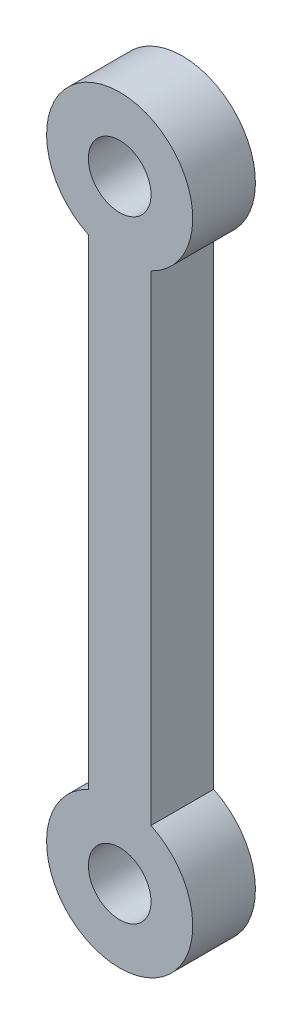
from build123d import *

# Parameters (mm, degrees)
ESTRUSIONE_ESTRUSIONE2_DEPTH = 3
TAGLIO_ESTRUSIONE7_START     = 3
SCHIZZO3_R                   = 1.5
TAGLIO_ESTRUSIONE7_DEPTH     = 71.735847184


with BuildPart() as part:
    # Schizzo2 → Estrusione-Estrusione2 (new body)
    with BuildSketch(Plane.XY):
        with BuildLine():
            Line((-34.111088775, -27.566511085), (-34.111088775, -50.566511085))
            ThreePointArc((-34.111088775, -50.566511085), (-32.611088775, -57.228788745), (-31.111088775, -50.566511085))
            Line((-31.111088775, -50.566511085), (-31.111088775, -27.566511085))
            ThreePointArc((-31.111088775, -27.566511085), (-32.611088775, -20.904233425), (-34.111088775, -27.566511085))
        make_face()
    extrude(amount=ESTRUSIONE_ESTRUSIONE2_DEPTH)

    # Schizzo3 → Taglio-Estrusione7 (cut, through all)
    with BuildSketch(Plane.XY.offset(TAGLIO_ESTRUSIONE7_START)):
        with Locations((-32.611088775, -24.404233425)):
            Circle(SCHIZZO3_R)
        with Locations((-32.611088775, -53.728788745)):
            Circle(SCHIZZO3_R)
    extrude(amount=-TAGLIO_ESTRUSIONE7_DEPTH, mode=Mode.SUBTRACT)


solid = part.part
